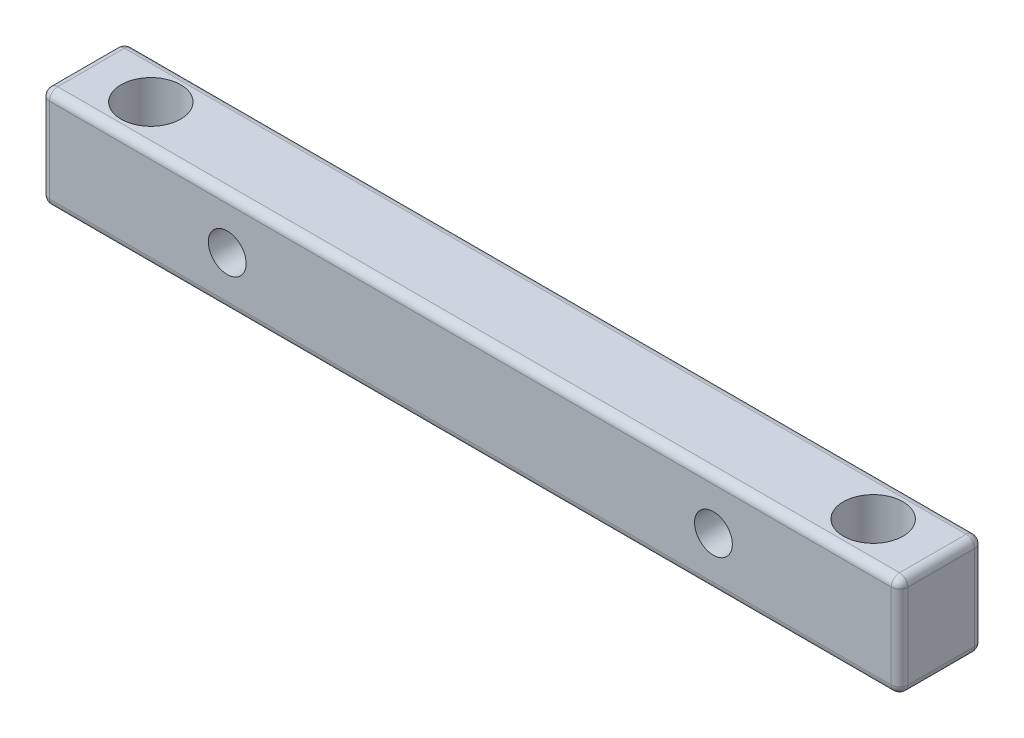
from build123d import *

# Parameters (mm, degrees)
SKETCH2_W           = 78.486
SKETCH2_H           = 7.62
SKETCH2_R           = 2.7305
BOSS_EXTRUDE1_DEPTH = 9.271
SKETCH3_R           = 1.7272
CUT_EXTRUDE1_DEPTH  = 7.62
FILLET1_R           = 0.762


with BuildPart() as part:
    # Sketch2 → Boss-Extrude1 (new body)
    with BuildSketch(Plane(origin=(0, 0, 0), x_dir=(1, 0, 0), z_dir=(0, 1, 0))):
        with Locations((39.243, 3.81)):
            Rectangle(SKETCH2_W, SKETCH2_H)
        with Locations(Location((6.223, 3.81, 0), (0, 0, 270))):
            Circle(SKETCH2_R, mode=Mode.SUBTRACT)
        with Locations(Location((72.263, 3.81, 0), (0, 0, 270))):
            Circle(SKETCH2_R, mode=Mode.SUBTRACT)
    extrude(amount=BOSS_EXTRUDE1_DEPTH)

    # Sketch3 → Cut-Extrude1 (cut)
    with BuildSketch(Plane.XY):
        with Locations((17.018, 4.6355)):
            Circle(SKETCH3_R)
        with Locations((61.468, 4.6355)):
            Circle(SKETCH3_R)
    extrude(amount=-CUT_EXTRUDE1_DEPTH, mode=Mode.SUBTRACT)

    # Fillet1
    fillet1_edges = [part.edges().sort_by_distance(p)[0] for p in [
        (78.486, 9.271, -3.81),
        (39.243, 9.271, -7.62),
        (0, 9.271, -3.81),
        (39.243, 0, -7.62),
        (78.486, 0, -3.81),
        (39.243, 0, 0),
        (0, 0, -3.81),
        (39.243, 9.271, 0),
        (0, 4.6355, -7.62),
        (78.486, 4.6355, -7.62),
        (78.486, 4.6355, 0),
        (0, 4.6355, 0),
    ]]
    fillet(fillet1_edges, radius=FILLET1_R)


solid = part.part
